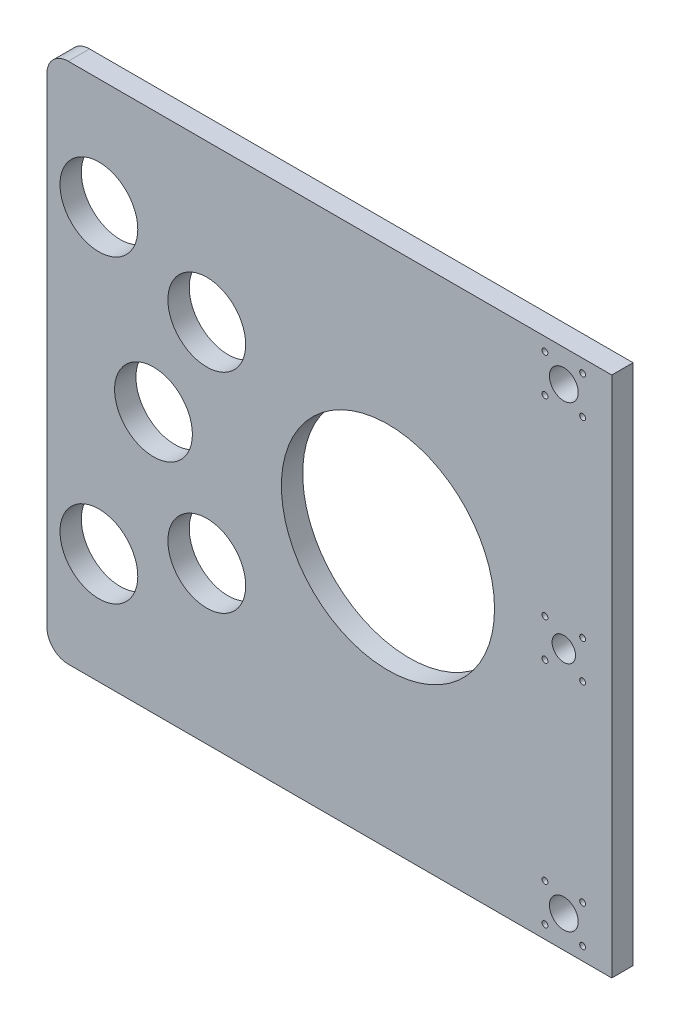
from build123d import *

# Parameters (mm, degrees)
SKETCH_1_W          = 530
SKETCH_1_H          = 490
SKETCH_1_R          = 36.5
SKETCH_1_R_2        = 2.75
SKETCH_1_R_3        = 13.5
SKETCH_1_R_4        = 11
EXTRUDE_1_DEPTH     = 20
FILLET_1_R          = 20
SKETCH_2_R          = 100
CUT_EXTRUDE_1_DEPTH = 496.302937605


with BuildPart() as part:
    # Эскиз1 → Бобышка-Вытянуть1 (new body)
    with BuildSketch(Plane.XY):
        with Locations((165, 0)):
            Rectangle(SKETCH_1_W, SKETCH_1_H)
        with Locations((-51.249933939, -140.973204089)):
            Circle(SKETCH_1_R, mode=Mode.SUBTRACT)
        with Locations((50, -97.979589711)):
            Circle(SKETCH_1_R, mode=Mode.SUBTRACT)
        with Locations((367.32233047, -232.67766953)):
            Circle(SKETCH_1_R_2, mode=Mode.SUBTRACT)
        with Locations((385, -215)):
            Circle(SKETCH_1_R_3, mode=Mode.SUBTRACT)
        with Locations((402.67766953, -232.67766953)):
            Circle(SKETCH_1_R_2, mode=Mode.SUBTRACT)
        with Locations((367.32233047, -197.32233047)):
            Circle(SKETCH_1_R_2, mode=Mode.SUBTRACT)
        with Locations((402.67766953, -197.32233047)):
            Circle(SKETCH_1_R_2, mode=Mode.SUBTRACT)
        with Locations((367.32233047, -17.67766953)):
            Circle(SKETCH_1_R_2, mode=Mode.SUBTRACT)
        with Locations((402.67766953, -17.67766953)):
            Circle(SKETCH_1_R_2, mode=Mode.SUBTRACT)
        Circle(SKETCH_1_R, mode=Mode.SUBTRACT)
        with Locations((50, 97.979589711)):
            Circle(SKETCH_1_R, mode=Mode.SUBTRACT)
        with Locations((-51.249933939, 140.973204089)):
            Circle(SKETCH_1_R, mode=Mode.SUBTRACT)
        with Locations((385, 0)):
            Circle(SKETCH_1_R_4, mode=Mode.SUBTRACT)
        with Locations((367.32233047, 17.67766953)):
            Circle(SKETCH_1_R_2, mode=Mode.SUBTRACT)
        with Locations((402.67766953, 17.67766953)):
            Circle(SKETCH_1_R_2, mode=Mode.SUBTRACT)
        with Locations((367.32233047, 197.32233047)):
            Circle(SKETCH_1_R_2, mode=Mode.SUBTRACT)
        with Locations((402.67766953, 197.32233047)):
            Circle(SKETCH_1_R_2, mode=Mode.SUBTRACT)
        with Locations((385, 215)):
            Circle(SKETCH_1_R_3, mode=Mode.SUBTRACT)
        with Locations((367.32233047, 232.67766953)):
            Circle(SKETCH_1_R_2, mode=Mode.SUBTRACT)
        with Locations((402.67766953, 232.67766953)):
            Circle(SKETCH_1_R_2, mode=Mode.SUBTRACT)
    extrude(amount=EXTRUDE_1_DEPTH)

    # Скругление1
    fillet_1_edges = [part.edges().sort_by_distance(p)[0] for p in [
        (-100, 245, 10),
        (-100, -245, 10),
    ]]
    fillet(fillet_1_edges, radius=FILLET_1_R)

    # Эскиз2 → Вырез-Вытянуть1 (cut, through all)
    with BuildSketch(Plane.XY.offset(20)):
        with Locations((220, 0)):
            Circle(SKETCH_2_R)
    extrude(amount=-CUT_EXTRUDE_1_DEPTH, mode=Mode.SUBTRACT)


solid = part.part
